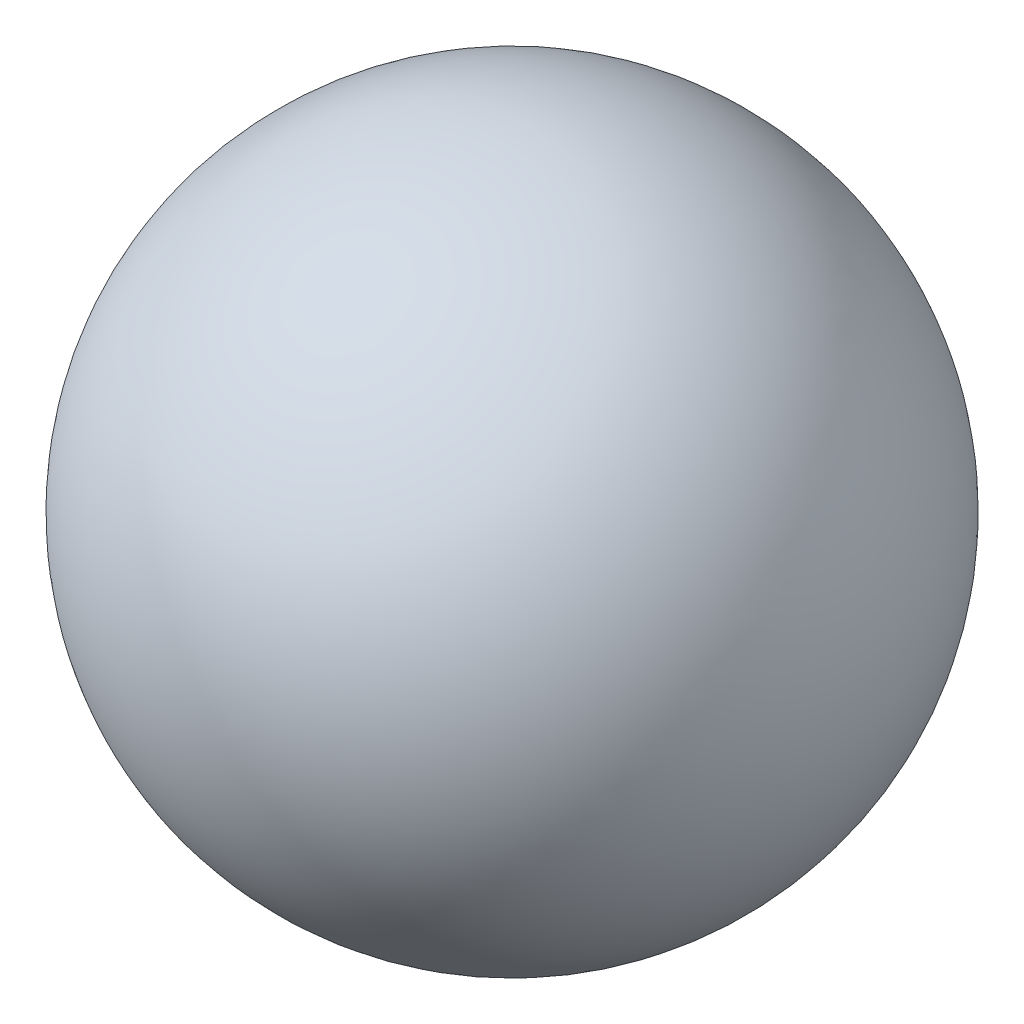
from build123d import *


with BuildPart() as part:
    # 草图1 → 旋转1 (revolve)
    with BuildSketch(Plane(origin=(0, 0, 0), x_dir=(1, 0, 0), z_dir=(0, 1, 0))):
        with BuildLine():
            Line((0, 0), (0, 17))
            ThreePointArc((0, 17), (8.5, 8.5), (0, 0))
        make_face()
    revolve(axis=Axis((0, 0, 0), (0, 0, -1)))


solid = part.part
